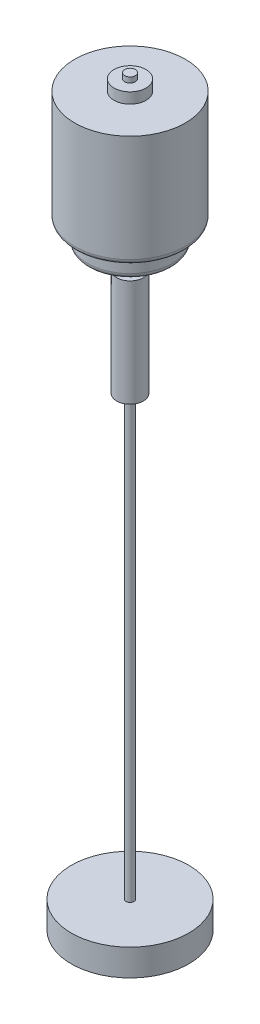
from build123d import *

# Parameters (mm, degrees)
CROQUIS2_R              = 3
SALIENTE_EXTRUIR1_DEPTH = 2
CROQUIS3_R              = 1
SALIENTE_EXTRUIR2_DEPTH = 1
SALIENTE_EXTRUIR3_START = 2.5
CROQUIS4_R              = 1
SALIENTE_EXTRUIR3_DEPTH = 2.5
CROQUIS5_R              = 2.5
SALIENTE_EXTRUIR4_DEPTH = 20
CROQUIS6_R              = 0.75
SALIENTE_EXTRUIR5_DEPTH = 82
CROQUIS7_R              = 11
SALIENTE_EXTRUIR6_DEPTH = 5
REDONDEO1_R             = 1


with BuildPart() as part:
    # Croquis1 → Revolución1 (revolve)
    with BuildSketch(Plane.XY, mode=Mode.PRIVATE) as revoluci_n1_sk:
        Polygon((0, 0), (0, 26.5), (10.35, 26.5), (10.35, 5.5), (7.9, 5.5), (7.9, 1.5), (3, 1.5), (3, 0), align=None)
    revolve(revoluci_n1_sk.sketch.rotate(Axis((0, 14.951468567, 0), (0, 1, 0)), 90), axis=Axis((0, 14.951468567, 0), (0, 1, 0)))

    # Croquis2 → Saliente-Extruir1 (add)
    with BuildSketch(Plane(origin=(0, 26.5, 0), x_dir=(1, 0, 0), z_dir=(0, 1, 0))):
        with Locations(Location((0, 0, 0), (0, 0, 90))):
            Circle(CROQUIS2_R)
    extrude(amount=SALIENTE_EXTRUIR1_DEPTH)

    # Croquis3 → Saliente-Extruir2 (add)
    with BuildSketch(Plane(origin=(0, 28.5, 0), x_dir=(1, 0, 0), z_dir=(0, 1, 0))):
        with Locations(Location((0, 0, 0), (0, 0, 270))):
            Circle(CROQUIS3_R)
    extrude(amount=SALIENTE_EXTRUIR2_DEPTH)

    # Croquis4 → Saliente-Extruir3 (add)
    with BuildSketch(Plane.XZ.offset(SALIENTE_EXTRUIR3_START)):
        with Locations(Location((0, 0, 0), (0, 0, 90))):
            Circle(CROQUIS4_R)
    extrude(amount=-SALIENTE_EXTRUIR3_DEPTH)

    # Croquis5 → Saliente-Extruir4 (add)
    with BuildSketch(Plane.XZ.offset(2.5)):
        with Locations(Location((0, 0, 0), (0, 0, 270))):
            Circle(CROQUIS5_R)
    extrude(amount=SALIENTE_EXTRUIR4_DEPTH)

    # Croquis6 → Saliente-Extruir5 (add)
    with BuildSketch(Plane.XZ.offset(22.5)):
        with Locations(Location((0, 0, 0), (0, 0, 270))):
            Circle(CROQUIS6_R)
    extrude(amount=SALIENTE_EXTRUIR5_DEPTH)

    # Croquis7 → Saliente-Extruir6 (add)
    with BuildSketch(Plane.XZ.offset(104.5)):
        with Locations(Location((0, 0, 0), (0, 0, 270))):
            Circle(CROQUIS7_R)
    extrude(amount=SALIENTE_EXTRUIR6_DEPTH)

    # Redondeo1
    redondeo1_edges = [part.edges().sort_by_distance(p)[0] for p in [
        (0, 1.5, 7.9),
        (0, 5.5, 7.9),
        (0, 5.5, 10.35),
    ]]
    fillet(redondeo1_edges, radius=REDONDEO1_R)


solid = part.part
